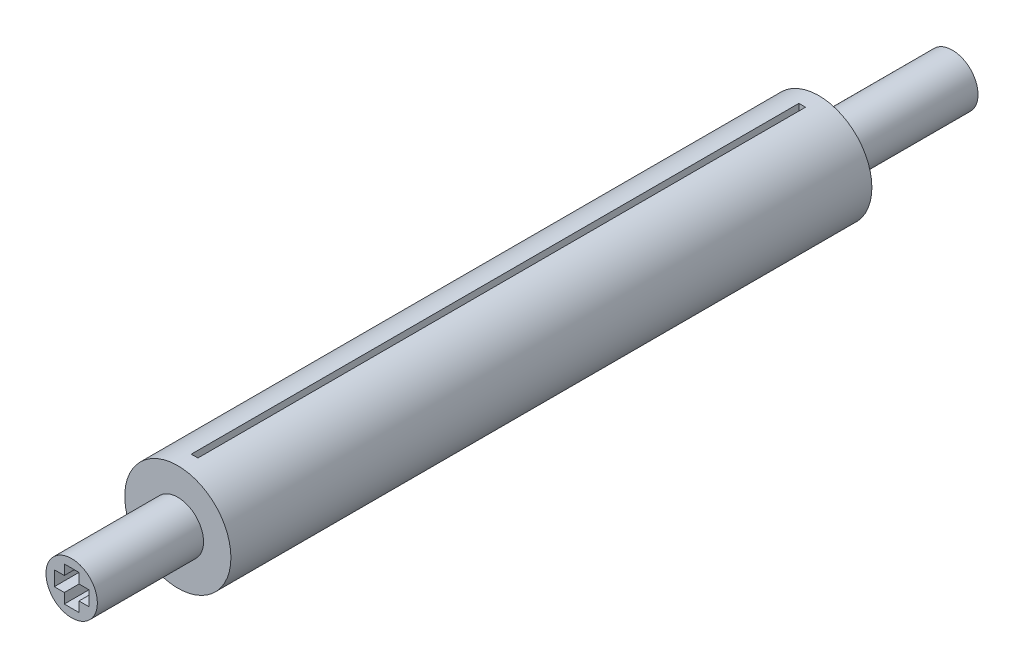
from build123d import *

# Parameters (mm, degrees)
SKETCH1_R           = 7.95
BOSS_EXTRUDE1_DEPTH = 48
SKETCH3_R           = 3.85
BOSS_EXTRUDE2_DEPTH = 15.9
BOSS_EXTRUDE3_START = 20
SKETCH8_R           = 3.85
BOSS_EXTRUDE3_DEPTH = 20
CUT_EXTRUDE2_DEPTH  = 15.1
SKETCH4_W           = 1
SKETCH4_H           = 91
CUT_EXTRUDE1_DEPTH  = 10


with BuildPart() as part:
    # Sketch1 → Boss-Extrude1 (new, symmetric)
    with BuildSketch(Plane.XY):
        Circle(SKETCH1_R)
    extrude(amount=BOSS_EXTRUDE1_DEPTH, both=True)

    # Sketch3 → Boss-Extrude2 (add)
    with BuildSketch(Plane.XY.offset(48)):
        Circle(SKETCH3_R)
    extrude(amount=BOSS_EXTRUDE2_DEPTH)

    # Sketch8 → Boss-Extrude3 (add)
    with BuildSketch(Plane(origin=(0, 0, -48), x_dir=(-1, 0, 0), z_dir=(0, 0, -1)).offset(BOSS_EXTRUDE3_START)):
        with Locations(Location((0, 0, 0), (0, 0, 180))):
            Circle(SKETCH8_R)
    extrude(amount=-BOSS_EXTRUDE3_DEPTH)

    # Sketch6 → Cut-Extrude2 (cut)
    with BuildSketch(Plane.XY.offset(63.9)):
        Polygon((-1.1, 2.6), (1.1, 2.6), (1.1, 1.1), (2.6, 1.1), (2.6, -1.1), (1.1, -1.1), (1.1, -2.6), (-1.1, -2.6), (-1.1, -1.1), (-2.6, -1.1), (-2.6, 1.1), (-1.1, 1.1), align=None)
    extrude(amount=-CUT_EXTRUDE2_DEPTH, mode=Mode.SUBTRACT)

    # Sketch4 → Cut-Extrude1 (cut)
    with BuildSketch(Plane(origin=(0, 7.95, 0), x_dir=(1, 0, 0), z_dir=(0, 1, 0))):
        Rectangle(SKETCH4_W, SKETCH4_H)
    extrude(amount=-CUT_EXTRUDE1_DEPTH, mode=Mode.SUBTRACT)


solid = part.part
